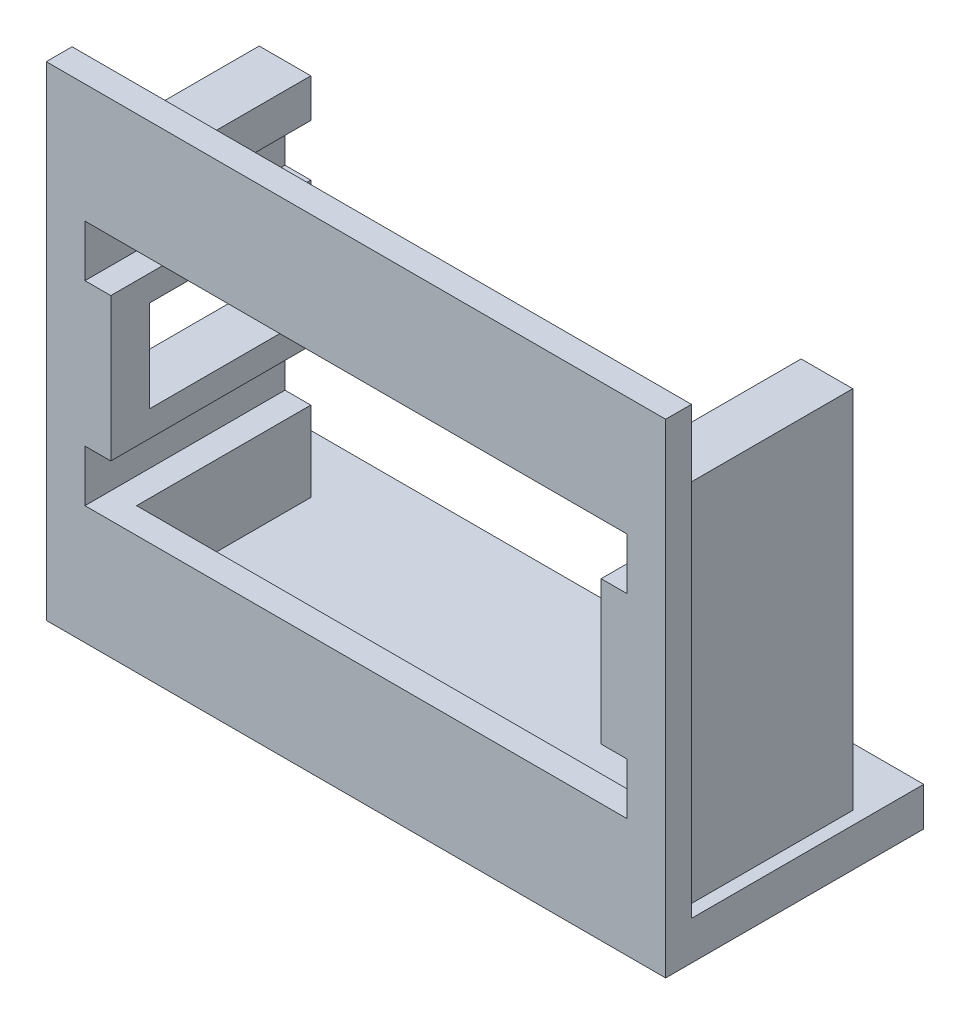
from build123d import *

# Parameters (mm, degrees)
SKETCH2_W                = 200
SKETCH2_H                = 150
BOSS_EXTRUDE1_DEPTH      = 80
FILLET1_R                = 10
SHELL1_T                 = -2
SHELL1_THICKNESS_2_DEPTH = 13
SKETCH5_W                = 36.5
SKETCH5_H                = 27.5
CUT_EXTRUDE1_DEPTH       = 2
BOSS_EXTRUDE2_DEPTH      = 16
SKETCH7_W                = 36.5
SKETCH7_H                = 27.5
CUT_EXTRUDE2_DEPTH       = 2
BOSS_EXTRUDE3_DEPTH      = 16
SKETCH10_W               = 36.5
SKETCH10_H               = 27.5
CUT_EXTRUDE4_DEPTH       = 2
BOSS_EXTRUDE4_DEPTH      = 16
SKETCH13_W               = 2
SKETCH13_H               = 4
CUT_EXTRUDE5_DEPTH       = 2
BOSS_EXTRUDE5_DEPTH      = 13.5
SKETCH15_W               = 10.5
SKETCH15_H               = 7.1
CUT_EXTRUDE6_DEPTH       = 4
CUT_EXTRUDE8_REACH       = 150.408
SKETCH20_R               = 8
SPLIT1_SURFACE_1_BACK    = 263.488
SPLIT1_SURFACE_1_DEPTH   = 526.976
SPLIT1_SURFACE_2_BACK    = 263.488
SPLIT1_SURFACE_2_DEPTH   = 526.976
SPLIT2_SURFACE_3_BACK    = 263.488
SPLIT2_SURFACE_3_DEPTH   = 526.976
SPLIT2_SURFACE_4_BACK    = 263.488
SPLIT2_SURFACE_4_DEPTH   = 526.976


with BuildPart() as part:
    # Sketch2 → Boss-Extrude1 (new body)
    with BuildSketch(Plane(origin=(0, 0, 0), x_dir=(1, 0, 0), z_dir=(0, 1, 0))):
        Rectangle(SKETCH2_W, SKETCH2_H)
    extrude(amount=BOSS_EXTRUDE1_DEPTH)

    # Fillet1
    fillet1_edges = [part.edges().sort_by_distance(p)[0] for p in [
        (100, 40, 75),
        (-100, 40, 75),
        (-100, 40, -75),
        (100, 40, -75),
    ]]
    fillet(fillet1_edges, radius=FILLET1_R)

    # Shell1
    shell1_openings = [part.faces().sort_by_distance(p)[0] for p in [
        (0, 80, 0),
    ]]
    offset(amount=SHELL1_T, openings=shell1_openings, kind=Kind.INTERSECTION)

    # Shell1 thickness 2 face (on inner face of the shell) → Shell1 thickness 2 (add)
    with BuildSketch(Plane(origin=(0, 2, 0), x_dir=(0, 0, -1), z_dir=(0, -1, 0))):
        with BuildLine():
            ThreePointArc((73, -90), (70.656854249, -95.656854249), (65, -98))
            Line((65, -98), (-65, -98))
            ThreePointArc((-65, -98), (-70.656854249, -95.656854249), (-73, -90))
            Line((-73, -90), (-73, 90))
            ThreePointArc((-73, 90), (-70.656854249, 95.656854249), (-65, 98))
            Line((-65, 98), (65, 98))
            ThreePointArc((65, 98), (70.656854249, 95.656854249), (73, 90))
            Line((73, 90), (73, -90))
        make_face()
    extrude(amount=-SHELL1_THICKNESS_2_DEPTH)

    # Sketch5 → Cut-Extrude1 (cut)
    with BuildSketch(Plane.XY.offset(75)):
        with Locations((0, 30.75)):
            Rectangle(SKETCH5_W, SKETCH5_H)
        Polygon((-18.25, 43.5), (-19.75, 44.366025404), (-19.75, 41.633974596), (-18.25, 42.5), align=None)
        Polygon((-19.75, 19.866025404), (-18.25, 19), (-18.25, 18), (-19.75, 17.133974596), align=None)
        Polygon((19.75, 17.133974596), (19.75, 19.866025404), (18.25, 19), (18.25, 18), align=None)
        Polygon((19.75, 41.633974596), (18.25, 42.5), (18.25, 43.5), (19.75, 44.366025404), align=None)
    extrude(amount=-CUT_EXTRUDE1_DEPTH, mode=Mode.SUBTRACT)

    # Sketch6 → Boss-Extrude2 (add)
    with BuildSketch(Plane(origin=(0, 0, 73), x_dir=(-1, 0, 0), z_dir=(0, 0, -1))):
        Polygon((18.25, 15), (21.25, 15), (21.25, 47.5), (18.25, 47.5), (18.25, 43.5), (19.75, 44.366025404), (19.75, 41.633974596), (18.25, 42.5), (18.25, 19), (19.75, 19.866025404), (19.75, 17.133974596), (18.25, 18), align=None)
        Polygon((-21.25, 47.5), (-21.25, 15), (-18.25, 15), (-18.25, 18), (-19.75, 17.133974596), (-19.75, 19.866025404), (-18.25, 19), (-18.25, 42.5), (-19.75, 41.633974596), (-19.75, 44.366025404), (-18.25, 43.5), (-18.25, 47.5), align=None)
    extrude(amount=BOSS_EXTRUDE2_DEPTH)

    # Sketch7 → Cut-Extrude2 (cut)
    with BuildSketch(Plane(origin=(100, 0, 0), x_dir=(0, 0, -1), z_dir=(1, 0, 0))):
        with Locations((0, 30.75)):
            Rectangle(SKETCH7_W, SKETCH7_H)
        Polygon((-18.25, 43.5), (-19.75, 44.366025404), (-19.75, 41.633974596), (-18.25, 42.5), align=None)
        Polygon((-19.75, 19.866025404), (-18.25, 19), (-18.25, 18), (-19.75, 17.133974596), align=None)
        Polygon((19.75, 17.133974596), (19.75, 19.866025404), (18.25, 19), (18.25, 18), align=None)
        Polygon((19.75, 41.633974596), (18.25, 42.5), (18.25, 43.5), (19.75, 44.366025404), align=None)
    extrude(amount=-CUT_EXTRUDE2_DEPTH, mode=Mode.SUBTRACT)

    # Sketch8 → Boss-Extrude3 (add)
    with BuildSketch(Plane.ZY.offset(-98)):
        Polygon((-21.25, 47.5), (-18.25, 47.5), (-18.25, 43.5), (-19.75, 44.366025404), (-19.75, 41.633974596), (-18.25, 42.5), (-18.25, 19), (-19.75, 19.866025404), (-19.75, 17.133974596), (-18.25, 18), (-18.25, 15), (-21.25, 15), align=None)
        Polygon((19.75, 44.366025404), (18.25, 43.5), (18.25, 47.5), (21.25, 47.5), (21.25, 15), (18.25, 15), (18.25, 18), (19.75, 17.133974596), (19.75, 19.866025404), (18.25, 19), (18.25, 42.5), (19.75, 41.633974596), align=None)
    extrude(amount=BOSS_EXTRUDE3_DEPTH)

    # Sketch10 → Cut-Extrude4 (cut)
    with BuildSketch(Plane.ZY.offset(100)):
        with Locations((0, 30.75)):
            Rectangle(SKETCH10_W, SKETCH10_H)
        Polygon((-18.25, 43.5), (-19.75, 44.366025404), (-19.75, 41.633974596), (-18.25, 42.5), align=None)
        Polygon((-19.75, 19.866025404), (-18.25, 19), (-18.25, 18), (-19.75, 17.133974596), align=None)
        Polygon((19.75, 17.133974596), (19.75, 19.866025404), (18.25, 19), (18.25, 18), align=None)
        Polygon((19.75, 41.633974596), (18.25, 42.5), (18.25, 43.5), (19.75, 44.366025404), align=None)
    extrude(amount=-CUT_EXTRUDE4_DEPTH, mode=Mode.SUBTRACT)

    # Sketch11 → Boss-Extrude4 (add)
    with BuildSketch(Plane(origin=(-98, 0, 0), x_dir=(0, 0, -1), z_dir=(1, 0, 0))):
        Polygon((-18.25, 47.5), (-21.25, 47.5), (-21.25, 15), (-18.25, 15), (-18.25, 18), (-19.75, 17.133974596), (-19.75, 19.866025404), (-18.25, 19), (-18.25, 42.5), (-19.75, 41.633974596), (-19.75, 44.366025404), (-18.25, 43.5), align=None)
        Polygon((19.75, 44.366025404), (18.25, 43.5), (18.25, 47.5), (21.25, 47.5), (21.25, 15), (18.25, 15), (18.25, 18), (19.75, 17.133974596), (19.75, 19.866025404), (18.25, 19), (18.25, 42.5), (19.75, 41.633974596), align=None)
    extrude(amount=BOSS_EXTRUDE4_DEPTH)

    # Sketch13 → Cut-Extrude5 (cut)
    with BuildSketch(Plane.XY.offset(75)):
        with Locations((40, 38.3)):
            Rectangle(SKETCH13_W, SKETCH13_H)
        Polygon((79, 40.3), (41, 40.3), (41, 36.3), (41, 25.2), (41, 21.2), (79, 21.2), (79, 25.2), (79, 36.3), align=None)
        with Locations((80, 38.3)):
            Rectangle(SKETCH13_W, SKETCH13_H)
        with Locations((40, 23.2)):
            Rectangle(SKETCH13_W, SKETCH13_H)
        with Locations((80, 23.2)):
            Rectangle(SKETCH13_W, SKETCH13_H)
    extrude(amount=-CUT_EXTRUDE5_DEPTH, mode=Mode.SUBTRACT)

    # Sketch14 → Boss-Extrude5 (add)
    with BuildSketch(Plane(origin=(0, 0, 73), x_dir=(-1, 0, 0), z_dir=(0, 0, -1))):
        Polygon((-79, 43.3), (-83, 43.3), (-83, 15), (-79, 15), (-79, 21.2), (-81, 21.2), (-81, 25.2), (-79, 25.2), (-79, 36.3), (-81, 36.3), (-81, 40.3), (-79, 40.3), align=None)
        Polygon((-39, 40.3), (-41, 40.3), (-41, 43.3), (-37, 43.3), (-37, 15), (-41, 15), (-41, 21.2), (-39, 21.2), (-39, 25.2), (-41, 25.2), (-41, 36.3), (-39, 36.3), align=None)
    extrude(amount=BOSS_EXTRUDE5_DEPTH)

    # Sketch15 → Cut-Extrude6 (cut)
    with BuildSketch(Plane.ZY.offset(-37)):
        with Locations((66.75, 30.75)):
            Rectangle(SKETCH15_W, SKETCH15_H)
    extrude(amount=-CUT_EXTRUDE6_DEPTH, mode=Mode.SUBTRACT)

    # Sketch18 → Cut-Revolve1 (revolve, cut)
    with BuildSketch(Plane(origin=(0, 0, 0), x_dir=(0, 0, -1), z_dir=(1, 0, 0)), mode=Mode.PRIVATE) as cut_revolve1_sk:
        Polygon((-42.5, 0), (-70, 0), (-47.5, 10), (-42.5, 10), align=None)
    revolve(cut_revolve1_sk.sketch.rotate(Axis((0, 0, 0), (0, 1, 0)), 180), axis=Axis((0, 0, 0), (0, 1, 0)), mode=Mode.SUBTRACT)

    # Cut-Extrude8: up to this face of the body (flat: up to its plane)
    cut_extrude8_end = Plane(part.part.faces().sort_by_distance((-0.230072279, 15, -0.475589226))[0])
    # Sketch20 → Cut-Extrude8 (cut, up to the picked face)
    with BuildSketch(Plane.XZ, mode=Mode.PRIVATE) as cut_extrude8_sk1:
        with Locations(Location((0, -42.5, 0), (0, 0, 270))):
            Circle(SKETCH20_R)
    cut_extrude8_tool1 = split(extrude(cut_extrude8_sk1.sketch, amount=-CUT_EXTRUDE8_REACH, mode=Mode.PRIVATE), bisect_by=cut_extrude8_end, keep=Keep.BOTH, mode=Mode.PRIVATE)
    add(cut_extrude8_tool1.solids().sort_by(Axis((0, 0, -42.5), (0, 1, 0)))[0], mode=Mode.SUBTRACT)


with BuildPart() as body_2:
    # Split1: the piece behind the surface
    add(part.part)
    # Split1 surface: a surface, the sketch's curves swept straight by 526.976 mm
    with BuildLine(Plane.XY.offset(75).offset(-SPLIT1_SURFACE_1_BACK), mode=Mode.PRIVATE) as split1_surface_1_path:
        Line((36, 49.5), (84, 49.5))
        Line((84, 49.5), (84, 12))
        Line((84, 12), (36, 12))
        Line((36, 12), (36, 49.5))
    split1_surface_1 = Shell.extrude(split1_surface_1_path.wire(), (0 * SPLIT1_SURFACE_1_DEPTH, 0 * SPLIT1_SURFACE_1_DEPTH, 1 * SPLIT1_SURFACE_1_DEPTH))
    split(bisect_by=split1_surface_1, keep=Keep.BOTTOM)


with BuildPart() as part_1:
    add(part.part)

    # Split1: split by a surface, the side it looks to stays
    # Split1 surface: a surface, the sketch's curves swept straight by 526.976 mm
    with BuildLine(Plane.XY.offset(75).offset(-SPLIT1_SURFACE_2_BACK), mode=Mode.PRIVATE) as split1_surface_2_path:
        Line((36, 49.5), (84, 49.5))
        Line((84, 49.5), (84, 12))
        Line((84, 12), (36, 12))
        Line((36, 12), (36, 49.5))
    split1_surface_2 = Shell.extrude(split1_surface_2_path.wire(), (0 * SPLIT1_SURFACE_2_DEPTH, 0 * SPLIT1_SURFACE_2_DEPTH, 1 * SPLIT1_SURFACE_2_DEPTH))
    split(bisect_by=split1_surface_2, keep=Keep.TOP)


with BuildPart() as body_3:
    # Split2: the piece behind the surface
    add(body_2.part)
    # Split2 surface: a surface, the sketch's curves swept straight by 526.976 mm
    with BuildLine(Plane(origin=(0, 15, 0), x_dir=(1, 0, 0), z_dir=(0, 1, 0)).offset(-SPLIT2_SURFACE_3_BACK), mode=Mode.PRIVATE) as split2_surface_3_path:
        Line((36, -75), (84, -75))
        Line((84, -75), (84, -55))
        Line((84, -55), (36, -55))
        Line((36, -55), (36, -75))
    split2_surface_3 = Shell.extrude(split2_surface_3_path.wire(), (0 * SPLIT2_SURFACE_3_DEPTH, 1 * SPLIT2_SURFACE_3_DEPTH, 0 * SPLIT2_SURFACE_3_DEPTH))
    split(bisect_by=split2_surface_3, keep=Keep.BOTTOM)


with BuildPart() as body_2_1:
    add(body_2.part)

    # Split2: split by a surface, the side it looks to stays
    # Split2 surface: a surface, the sketch's curves swept straight by 526.976 mm
    with BuildLine(Plane(origin=(0, 15, 0), x_dir=(1, 0, 0), z_dir=(0, 1, 0)).offset(-SPLIT2_SURFACE_4_BACK), mode=Mode.PRIVATE) as split2_surface_4_path:
        Line((36, -75), (84, -75))
        Line((84, -75), (84, -55))
        Line((84, -55), (36, -55))
        Line((36, -55), (36, -75))
    split2_surface_4 = Shell.extrude(split2_surface_4_path.wire(), (0 * SPLIT2_SURFACE_4_DEPTH, 1 * SPLIT2_SURFACE_4_DEPTH, 0 * SPLIT2_SURFACE_4_DEPTH))
    split(bisect_by=split2_surface_4, keep=Keep.TOP)


solid = body_2_1.part
